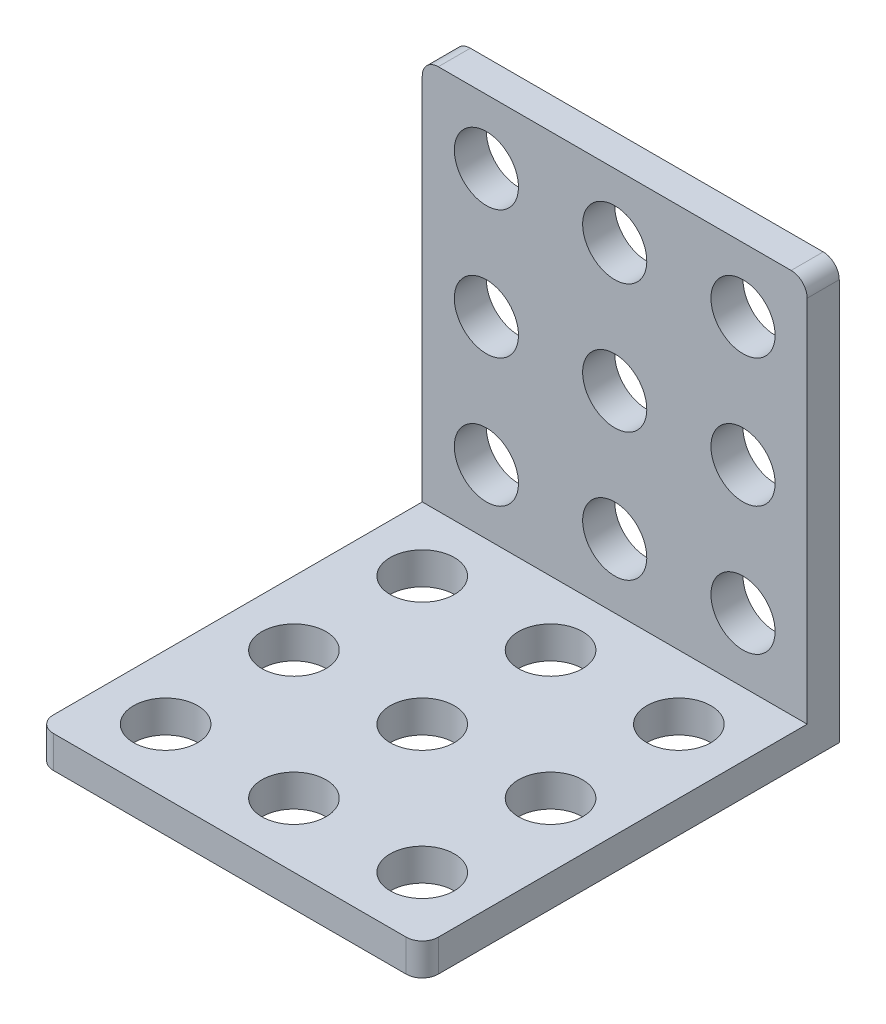
from build123d import *

# Parameters (mm, degrees)
EXTRUDE_1_DEPTH          = 24
CUT_EXTRUDE_1_DEPTH      = 24
CUT_EXTRUDE_1_DEPTH_BACK = 24
SKETCH_2_R               = 2
CUT_EXTRUDE_2_DEPTH      = 24
CUT_EXTRUDE_2_DEPTH_BACK = 24
SKETCH_3_R               = 2


with BuildPart() as part:
    # Эскиз1 → Бобышка-Вытянуть1 (new body)
    with BuildSketch(Plane(origin=(0, 0, 0), x_dir=(0, 0, -1), z_dir=(1, 0, 0))):
        Polygon((0, 0), (-26, 0), (-26, 2), (-2, 2), (-2, 26), (0, 26), align=None)
    extrude(amount=EXTRUDE_1_DEPTH)

    # Эскиз2 → Вырез-Вытянуть1 (cut, two sides: drawn at the far end of the back side and taken through both)
    with BuildSketch(Plane.XY.offset(-CUT_EXTRUDE_1_DEPTH_BACK)):
        with Locations(Location((12, 14, 0), (0, 0, 90))):
            Circle(SKETCH_2_R)
        with Locations(Location((4, 14, 0), (0, 0, 90))):
            Circle(SKETCH_2_R)
        with Locations(Location((20, 14, 0), (0, 0, 90))):
            Circle(SKETCH_2_R)
        with Locations(Location((12, 22, 0), (0, 0, 90))):
            Circle(SKETCH_2_R)
        with Locations(Location((4, 22, 0), (0, 0, 90))):
            Circle(SKETCH_2_R)
        with Locations(Location((20, 22, 0), (0, 0, 90))):
            Circle(SKETCH_2_R)
        with Locations(Location((12, 6, 0), (0, 0, 90))):
            Circle(SKETCH_2_R)
        with Locations(Location((4, 6, 0), (0, 0, 90))):
            Circle(SKETCH_2_R)
        with Locations(Location((20, 6, 0), (0, 0, 90))):
            Circle(SKETCH_2_R)
        with BuildLine():
            Line((0, 26), (0, 25))
            ThreePointArc((0, 25), (0.292893219, 25.707106781), (1, 26))
            Line((1, 26), (0, 26))
        make_face()
        with BuildLine():
            Line((24, 26), (23, 26))
            ThreePointArc((23, 26), (23.707106781, 25.707106781), (24, 25))
            Line((24, 25), (24, 26))
        make_face()
    extrude(amount=CUT_EXTRUDE_1_DEPTH + CUT_EXTRUDE_1_DEPTH_BACK, mode=Mode.SUBTRACT)

    # Эскиз3 → Вырез-Вытянуть2 (cut, two sides: drawn at the far end of the back side and taken through both)
    with BuildSketch(Plane(origin=(0, 0, 0), x_dir=(1, 0, 0), z_dir=(0, 1, 0)).offset(-CUT_EXTRUDE_2_DEPTH_BACK)):
        with Locations(Location((12, -14, 0), (0, 0, 90))):
            Circle(SKETCH_3_R)
        with Locations(Location((4, -14, 0), (0, 0, 90))):
            Circle(SKETCH_3_R)
        with Locations(Location((20, -14, 0), (0, 0, 90))):
            Circle(SKETCH_3_R)
        with Locations(Location((12, -6, 0), (0, 0, 90))):
            Circle(SKETCH_3_R)
        with Locations(Location((4, -6, 0), (0, 0, 90))):
            Circle(SKETCH_3_R)
        with Locations(Location((20, -6, 0), (0, 0, 90))):
            Circle(SKETCH_3_R)
        with Locations(Location((12, -22, 0), (0, 0, 90))):
            Circle(SKETCH_3_R)
        with Locations(Location((4, -22, 0), (0, 0, 90))):
            Circle(SKETCH_3_R)
        with Locations(Location((20, -22, 0), (0, 0, 90))):
            Circle(SKETCH_3_R)
        with BuildLine():
            Line((0, -25), (0, -26))
            Line((0, -26), (1, -26))
            ThreePointArc((1, -26), (0.292893219, -25.707106781), (0, -25))
        make_face()
        with BuildLine():
            Line((24, -26), (23, -26))
            ThreePointArc((23, -26), (23.707106781, -25.707106781), (24, -25))
            Line((24, -25), (24, -26))
        make_face()
    extrude(amount=CUT_EXTRUDE_2_DEPTH + CUT_EXTRUDE_2_DEPTH_BACK, mode=Mode.SUBTRACT)


solid = part.part
